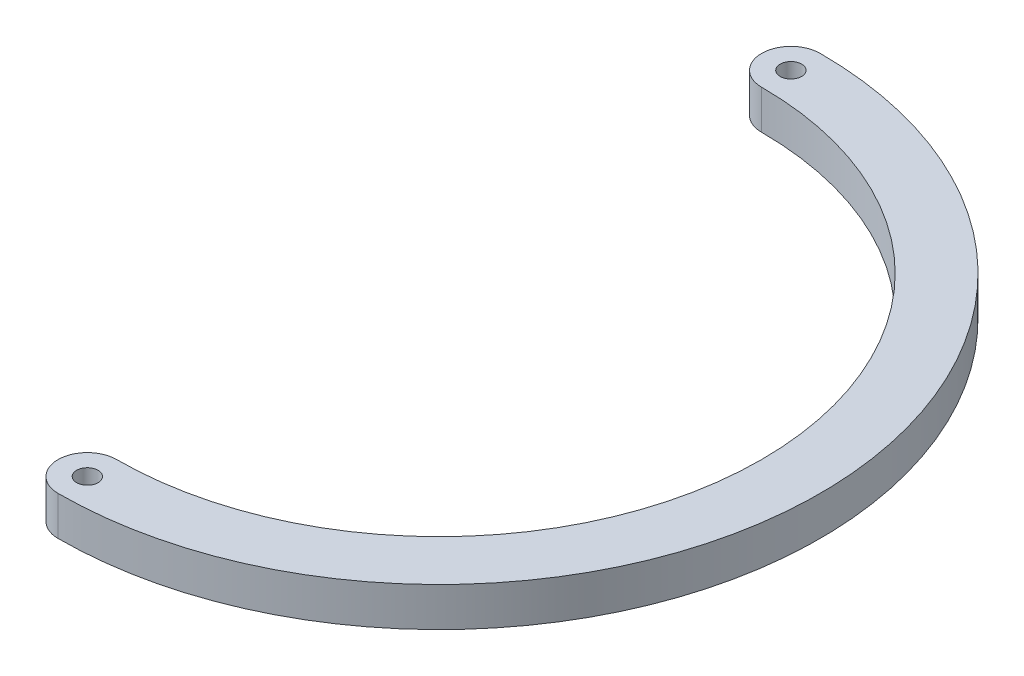
from build123d import *

# Parameters (mm, degrees)
BOSS_EXTRUDE1_DEPTH  = 5
M5_CLEARANCE_HOLE1_D = 5.5


with BuildPart() as part:
    # Sketch1 → Boss-Extrude1 (new, symmetric)
    with BuildSketch(Plane(origin=(0, 0, 0), x_dir=(1, 0, 0), z_dir=(0, 1, 0))):
        with BuildLine():
            ThreePointArc((0, 82.55), (82.55, 0), (0, -82.55))
            ThreePointArc((0, -82.55), (-7.5, -90.05), (0, -97.55))
            ThreePointArc((0, -97.55), (74.727635426, -62.703931325), (96.067996306, 16.939379731))
            ThreePointArc((96.067996306, 16.939379731), (74.727635426, 62.703931325), (33.364064981, 91.667015158))
            ThreePointArc((33.364064981, 91.667015158), (16.939379731, 96.067996306), (0, 97.55))
            ThreePointArc((0, 97.55), (-7.5, 90.05), (0, 82.55))
        make_face()
    extrude(amount=BOSS_EXTRUDE1_DEPTH, both=True)

    # M5 Clearance Hole1 (through all)
    with Locations(Plane(origin=(0, 5, 0), x_dir=(1, 0, 0), z_dir=(0, 1, 0))):
        with Locations((0, 90.05), (0, -90.05)):
            Hole(M5_CLEARANCE_HOLE1_D / 2)


solid = part.part
